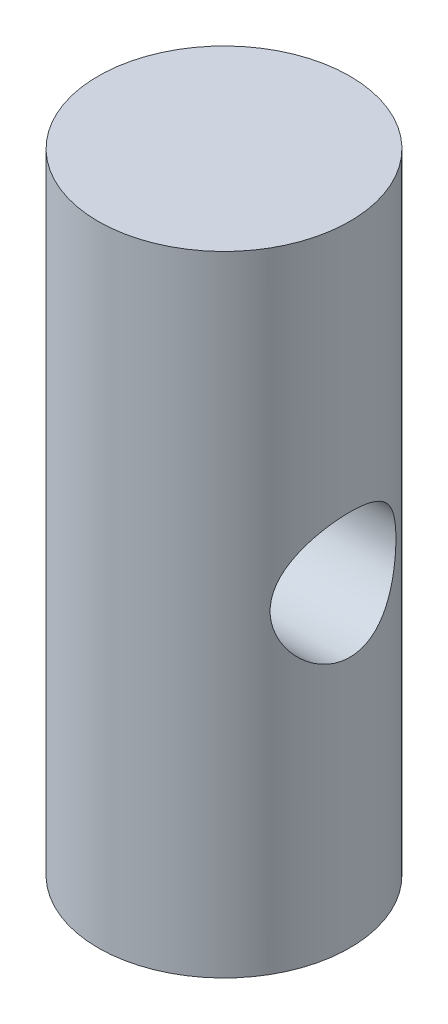
from build123d import *

# Parameters (mm, degrees)
SKETCH1_R           = 5
BOSS_EXTRUDE1_DEPTH = 25
SKETCH2_R           = 2.5
CUT_EXTRUDE1_DEPTH  = 5


with BuildPart() as part:
    # Sketch1 → Boss-Extrude1 (new body)
    with BuildSketch(Plane(origin=(0, 0, 0), x_dir=(1, 0, 0), z_dir=(0, 1, 0))):
        with Locations(Location((0, 0, 0), (0, 0, 270))):
            Circle(SKETCH1_R)
    extrude(amount=BOSS_EXTRUDE1_DEPTH)

    # Sketch2 → Cut-Extrude1 (cut, symmetric)
    with BuildSketch(Plane(origin=(0, 0, 0), x_dir=(0, 0, -1), z_dir=(1, 0, 0))):
        with Locations((0, 12.5)):
            Circle(SKETCH2_R)
    extrude(amount=CUT_EXTRUDE1_DEPTH, both=True, mode=Mode.SUBTRACT)


solid = part.part
